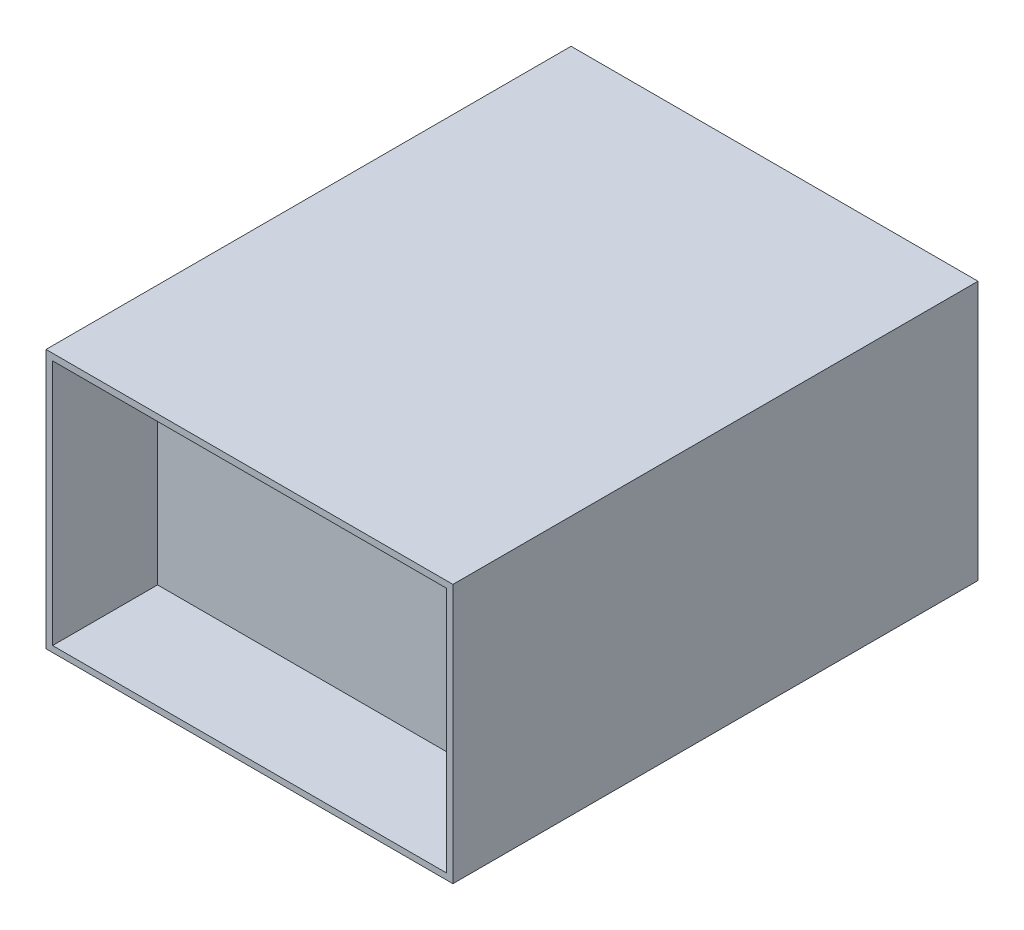
from build123d import *

# Parameters (mm, degrees)
SKETCH1_W           = 6200
SKETCH1_H           = 3950
BOSS_EXTRUDE1_DEPTH = 8000
SKETCH2_W           = 5000
SKETCH2_H           = 3500
CUT_EXTRUDE3_DEPTH  = 6200
SKETCH4_W           = 450
SKETCH4_H           = 3750
CUT_EXTRUDE5_DEPTH  = 6200
SKETCH5_W           = 5000
SKETCH5_H           = 200
CUT_EXTRUDE6_DEPTH  = 8000
SKETCH6_W           = 6000
SKETCH6_H           = 3757.085511021
CUT_EXTRUDE8_DEPTH  = 1600


with BuildPart() as part:
    # Sketch1 → Boss-Extrude1 (new body)
    with BuildSketch(Plane.XY):
        Rectangle(SKETCH1_W, SKETCH1_H)
    extrude(amount=BOSS_EXTRUDE1_DEPTH)

    # Sketch2 → Cut-Extrude3 (cut)
    with BuildSketch(Plane.XY):
        with Locations((0, -125)):
            Rectangle(SKETCH2_W, SKETCH2_H)
    extrude(amount=CUT_EXTRUDE3_DEPTH, mode=Mode.SUBTRACT)

    # Sketch4 → Cut-Extrude5 (cut)
    with BuildSketch(Plane.XY):
        with Locations((2775, 0)):
            Rectangle(SKETCH4_W, SKETCH4_H)
        with Locations((-2775, -7.085511021)):
            Rectangle(SKETCH4_W, SKETCH4_H)
    extrude(amount=CUT_EXTRUDE5_DEPTH, mode=Mode.SUBTRACT)

    # Sketch5 → Cut-Extrude6 (cut)
    with BuildSketch(Plane(origin=(0, 0, 0), x_dir=(-1, 0, 0), z_dir=(0, 0, -1))):
        with Locations((0, 1775)):
            Rectangle(SKETCH5_W, SKETCH5_H)
    extrude(amount=-CUT_EXTRUDE6_DEPTH, mode=Mode.SUBTRACT)

    # Sketch6 → Cut-Extrude8 (cut)
    with BuildSketch(Plane.XY.offset(8000)):
        with Locations((0, -3.542755511)):
            Rectangle(SKETCH6_W, SKETCH6_H)
    extrude(amount=-CUT_EXTRUDE8_DEPTH, mode=Mode.SUBTRACT)


solid = part.part
